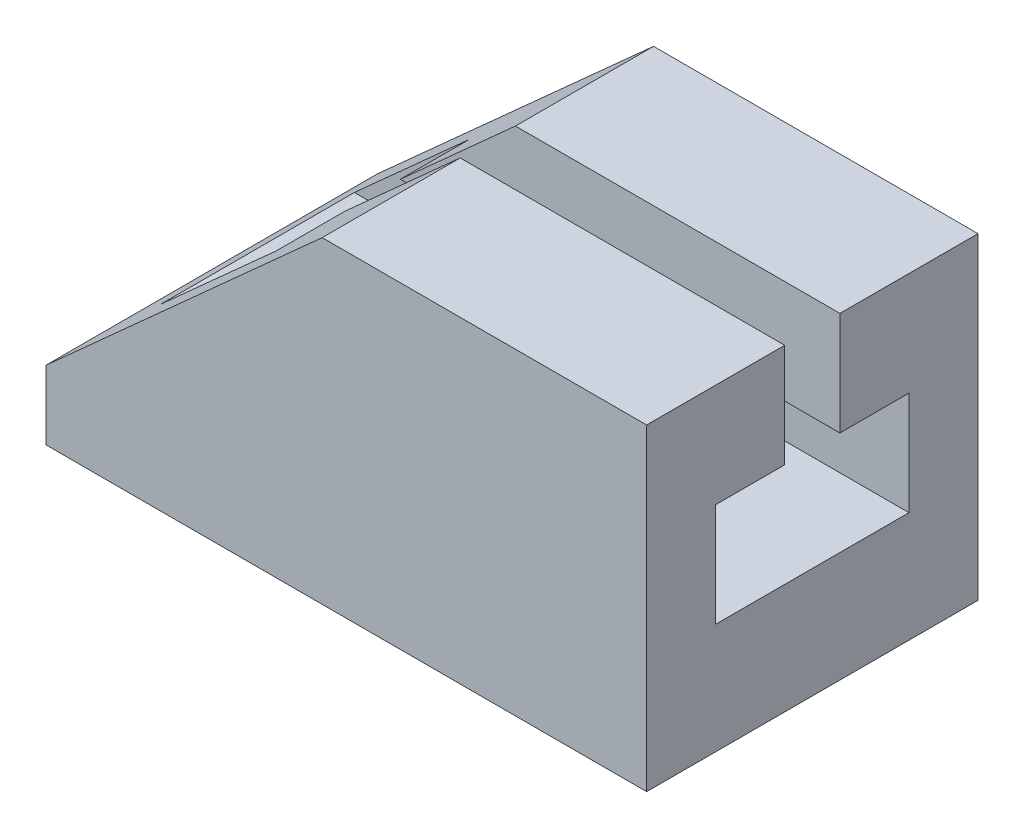
from build123d import *

# Parameters (mm, degrees)
BOSS_EXTRUDE1_DEPTH = 48
CUT_EXTRUDE1_DEPTH  = 110.494292089


with BuildPart() as part:
    # Sketch2 → Boss-Extrude1 (new body)
    with BuildSketch(Plane.XY):
        Polygon((0, 0), (0, 46), (-47, 46), (-87, 10), (-87, 0), align=None)
    extrude(amount=BOSS_EXTRUDE1_DEPTH)

    # Sketch3 → Cut-Extrude1 (cut, through all)
    with BuildSketch(Plane(origin=(0, 0, 0), x_dir=(0, 0, -1), z_dir=(1, 0, 0))):
        Polygon((-28, 46), (-20, 46), (-20, 31), (-10, 31), (-10, 16), (-38, 16), (-38, 31), (-28, 31), align=None)
    extrude(amount=-CUT_EXTRUDE1_DEPTH, mode=Mode.SUBTRACT)


solid = part.part
